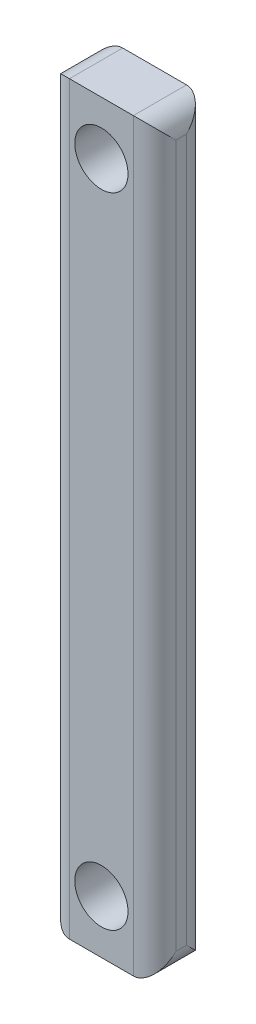
from build123d import *

# Parameters (mm, degrees)
SKETCH1_W           = 50
SKETCH1_H           = 350
SKETCH1_R           = 12.5
BOSS_EXTRUDE1_DEPTH = 25
FILLET1_R           = 10


with BuildPart() as part:
    # Sketch1 → Boss-Extrude1 (new body)
    with BuildSketch(Plane.XY):
        with Locations((-25, 175)):
            Rectangle(SKETCH1_W, SKETCH1_H)
        with Locations((-25, 25)):
            Circle(SKETCH1_R, mode=Mode.SUBTRACT)
        with Locations((-25, 325)):
            Circle(SKETCH1_R, mode=Mode.SUBTRACT)
    extrude(amount=BOSS_EXTRUDE1_DEPTH)

    # Fillet1
    fillet1_edges = [part.edges().sort_by_distance(p)[0] for p in [
        (-50, 175, 25),
        (0, 175, 25),
        (-50, 175, 0),
        (0, 175, 0),
        (0, 0, 12.5),
        (-50, 0, 12.5),
        (-50, 350, 12.5),
        (0, 350, 12.5),
    ]]
    fillet(fillet1_edges, radius=FILLET1_R)


solid = part.part
